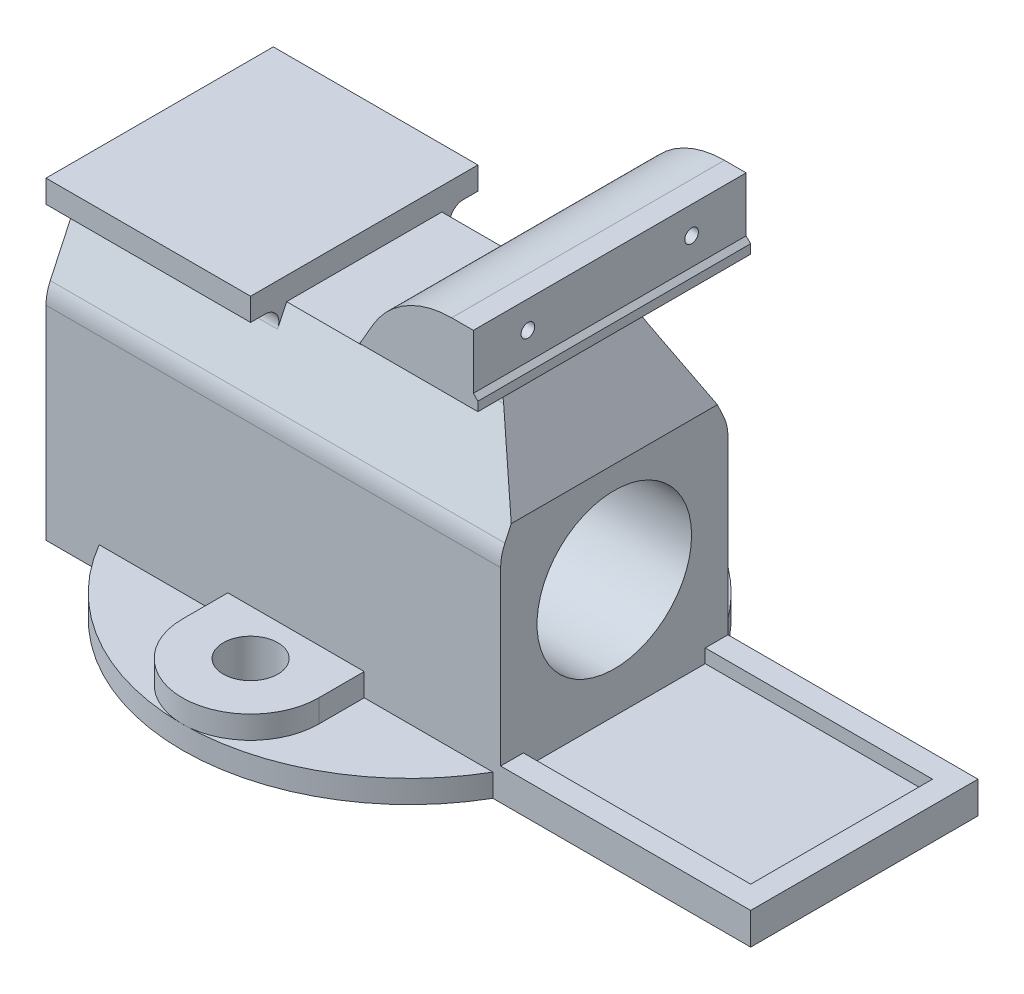
from build123d import *

# Parameters (mm, degrees)
BOSS_EXTRUDE1_DEPTH = 25
SKETCH3_W           = 50
SKETCH3_H           = 40
CUT_EXTRUDE1_DEPTH  = 3
BOSS_EXTRUDE5_DEPTH = 30
SKETCH4_R           = 1.5
CUT_EXTRUDE2_DEPTH  = 5
SKETCH5_R           = 17
CUT_EXTRUDE3_DEPTH  = 140.154590294
SKETCH6_R           = 2.5
CUT_EXTRUDE4_DEPTH  = 10
SKETCH8_R           = 6
BOSS_EXTRUDE2_DEPTH = 5
SKETCH8_3_R         = 6
BOSS_EXTRUDE3_DEPTH = 10
CUT_EXTRUDE5_DEPTH  = 145.789502382
SKETCH10_W          = 45
SKETCH10_H          = 50
BOSS_EXTRUDE4_DEPTH = 5
FILLET1_R           = 3
FILLET2_R           = 10


with BuildPart() as part:
    # Sketch2 → Boss-Extrude1 (new, symmetric)
    with BuildSketch(Plane.XY):
        with BuildLine():
            Line((55, 7), (0, 7))
            Line((0, 7), (0, 52))
            Line((0, 52), (-10.103629711, 69.5))
            ThreePointArc((-10.103629711, 69.5), (-10.103629711, 74.5), (-5.773502692, 77))
            Line((-5.773502692, 77), (0, 77))
            Line((0, 77), (0, 79))
            Line((0, 79), (-1, 80))
            Line((-1, 80), (-1, 92))
            Line((-1, 92), (-5.773502692, 92))
            ThreePointArc((-5.773502692, 92), (-15.773502692, 89.320508076), (-23.094010768, 82))
            Line((-23.094010768, 82), (-30.599564267, 69))
            ThreePointArc((-30.599564267, 69), (-34.259818305, 65.339745962), (-39.259818305, 64))
            Line((-39.259818305, 64), (-100, 64))
            Line((-100, 64), (-100, 0))
            Line((-100, 0), (55, 0))
            Line((55, 0), (55, 7))
        make_face()
    extrude(amount=BOSS_EXTRUDE1_DEPTH, both=True)

    # Sketch3 → Cut-Extrude1 (cut)
    with BuildSketch(Plane(origin=(0, 7, 0), x_dir=(1, 0, 0), z_dir=(0, 1, 0))):
        with Locations((25, 0)):
            Rectangle(SKETCH3_W, SKETCH3_H)
    extrude(amount=-CUT_EXTRUDE1_DEPTH, mode=Mode.SUBTRACT)

    # Sketch2<4> → Boss-Extrude5 (add, symmetric)
    with BuildSketch(Plane.XY):
        with BuildLine():
            Line((-25.980762114, 77), (-5.773502692, 77))
            Line((-5.773502692, 77), (0, 77))
            Line((0, 77), (0, 79))
            Line((0, 79), (-1, 80))
            Line((-1, 80), (-1, 92))
            Line((-1, 92), (-5.773502692, 92))
            ThreePointArc((-5.773502692, 92), (-15.773502692, 89.320508076), (-23.094010768, 82))
            Line((-23.094010768, 82), (-25.980762114, 77))
        make_face()
    extrude(amount=BOSS_EXTRUDE5_DEPTH, both=True)

    # Sketch4 → Cut-Extrude2 (cut)
    with BuildSketch(Plane(origin=(-1, 0, 0), x_dir=(0, 0, -1), z_dir=(1, 0, 0))):
        with Locations((-18, 86)):
            Circle(SKETCH4_R)
        with Locations((18, 86)):
            Circle(SKETCH4_R)
    extrude(amount=-CUT_EXTRUDE2_DEPTH, mode=Mode.SUBTRACT)

    # Sketch5 → Cut-Extrude3 (cut, through all)
    with BuildSketch(Plane(origin=(0, 0, 0), x_dir=(0, 0, -1), z_dir=(1, 0, 0))):
        with Locations((0, 30)):
            Circle(SKETCH5_R)
    extrude(amount=-CUT_EXTRUDE3_DEPTH, mode=Mode.SUBTRACT)

    # Sketch6 → Cut-Extrude4 (cut)
    with BuildSketch(Plane.ZY.offset(100)):
        with Locations((0, 52.5)):
            Circle(SKETCH6_R)
        with Locations((0, 7.5)):
            Circle(SKETCH6_R)
    extrude(amount=-CUT_EXTRUDE4_DEPTH, mode=Mode.SUBTRACT)

    # Sketch8 → Boss-Extrude2 (add)
    # profile 1 of 2: a face of its own
    with BuildSketch(Plane.XZ):
        with BuildLine():
            Line((-88.301270189, 25), (-1.698729811, 25))
            ThreePointArc((-1.698729811, 25), (-45, 50), (-88.301270189, 25))
        make_face()
        with Locations((-45, 35)):
            Circle(SKETCH8_R, mode=Mode.SUBTRACT)
    # profile 2 of 2: a face of its own
    with BuildSketch(Plane.XZ):
        with BuildLine():
            ThreePointArc((-88.301270189, -25), (-45, -50), (-1.698729811, -25))
            Line((-1.698729811, -25), (-88.301270189, -25))
        make_face()
        with Locations((-45, -35)):
            Circle(SKETCH8_R, mode=Mode.SUBTRACT)
    extrude(amount=-BOSS_EXTRUDE2_DEPTH)

    # Sketch8<3> → Boss-Extrude3 (add)
    # profile 1 of 2: a face of its own
    with BuildSketch(Plane.XZ):
        with BuildLine():
            Line((-60, 35), (-60, 25))
            Line((-60, 25), (-30, 25))
            Line((-30, 25), (-30, 35))
            ThreePointArc((-30, 35), (-45, 50), (-60, 35))
        make_face()
        with Locations((-45, 35)):
            Circle(SKETCH8_3_R, mode=Mode.SUBTRACT)
    # profile 2 of 2: a face of its own
    with BuildSketch(Plane.XZ):
        with BuildLine():
            Line((-30, -25), (-60, -25))
            Line((-60, -25), (-60, -35))
            ThreePointArc((-60, -35), (-45, -50), (-30, -35))
            Line((-30, -35), (-30, -25))
        make_face()
        with Locations((-45, -35)):
            Circle(SKETCH8_3_R, mode=Mode.SUBTRACT)
    extrude(amount=-BOSS_EXTRUDE3_DEPTH)

    # Sketch12 → Cut-Extrude5 (cut, through all)
    with BuildSketch(Plane(origin=(0, 0, 0), x_dir=(0, 0, -1), z_dir=(1, 0, 0))):
        with BuildLine():
            Line((25, 47), (15.654414786, 67.041672168))
            ThreePointArc((15.654414786, 67.041672168), (16.094829174, 73.761097258), (21.998569295, 77))
            Line((21.998569295, 77), (25, 77))
            Line((25, 77), (25, 47))
        make_face()
        with BuildLine():
            Line((-25, 77), (-25, 47))
            Line((-25, 47), (-15.654414786, 67.041672168))
            ThreePointArc((-15.654414786, 67.041672168), (-16.094829174, 73.761097258), (-21.998569295, 77))
            Line((-21.998569295, 77), (-25, 77))
        make_face()
    extrude(amount=-CUT_EXTRUDE5_DEPTH, mode=Mode.SUBTRACT)

    # Sketch10 → Boss-Extrude4 (add)
    with BuildSketch(Plane(origin=(0, 64, 0), x_dir=(1, 0, 0), z_dir=(0, 1, 0))):
        with Locations((-77.5, 0)):
            Rectangle(SKETCH10_W, SKETCH10_H)
    extrude(amount=BOSS_EXTRUDE4_DEPTH)

    # Fillet1
    fillet1_edges = [part.edges().sort_by_distance(p)[0] for p in [
        (-77.5, 64, -17.072769811),
        (-77.5, 64, 17.072769811),
    ]]
    fillet(fillet1_edges, radius=FILLET1_R)

    # Fillet2
    fillet2_edges = [part.edges().sort_by_distance(p)[0] for p in [
        (-50, 47, -25),
        (-50, 47, 25),
    ]]
    fillet(fillet2_edges, radius=FILLET2_R)


solid = part.part
